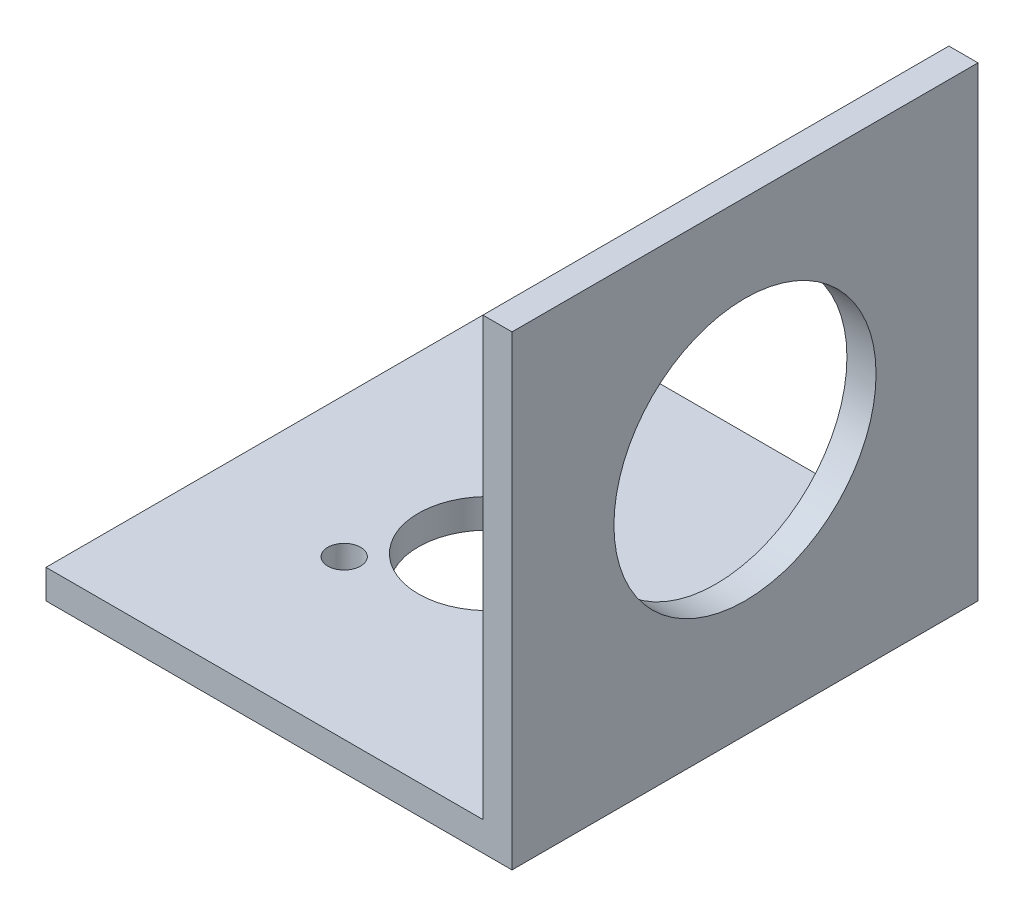
from build123d import *

# Parameters (mm, degrees)
BOSS_EXTRUDE1_DEPTH = 50.8
SKETCH2_R           = 14.2875
CUT_EXTRUDE1_DEPTH  = 50.8
SKETCH3_R           = 7.62
CUT_EXTRUDE2_DEPTH  = 50.8
SKETCH4_R           = 1.7859375
CUT_EXTRUDE3_DEPTH  = 12.7


with BuildPart() as part:
    # Sketch1 → Boss-Extrude1 (new body)
    with BuildSketch(Plane.XY):
        Polygon((0, 3.175), (0, 0), (47.625, 0), (50.8, 0), (50.8, 3.175), (50.8, 50.8), (47.625, 50.8), (47.625, 3.175), align=None)
    extrude(amount=BOSS_EXTRUDE1_DEPTH)

    # Sketch2 → Cut-Extrude1 (cut)
    with BuildSketch(Plane.ZY.offset(-47.625)):
        with Locations((25.4, 26.9875)):
            Circle(SKETCH2_R)
    extrude(amount=-CUT_EXTRUDE1_DEPTH, mode=Mode.SUBTRACT)

    # Sketch3 → Cut-Extrude2 (cut)
    with BuildSketch(Plane(origin=(0, 3.175, 0), x_dir=(1, 0, 0), z_dir=(0, 1, 0))):
        with Locations(Location((22.8092, -25.4, 0), (0, 0, 270))):
            Circle(SKETCH3_R)
    extrude(amount=-CUT_EXTRUDE2_DEPTH, mode=Mode.SUBTRACT)

    # Sketch4 → Cut-Extrude3 (cut)
    with BuildSketch(Plane.XZ):
        with Locations(Location((15.250391474, 33.54567799, 0), (0, 0, 270))):
            Circle(SKETCH4_R)
        with Locations(Location((19.534240193, 14.781040799, 0), (0, 0, 270))):
            Circle(SKETCH4_R)
        with Locations(Location((33.642968333, 27.873281211, 0), (0, 0, 270))):
            Circle(SKETCH4_R)
    extrude(amount=-CUT_EXTRUDE3_DEPTH, mode=Mode.SUBTRACT)


solid = part.part
